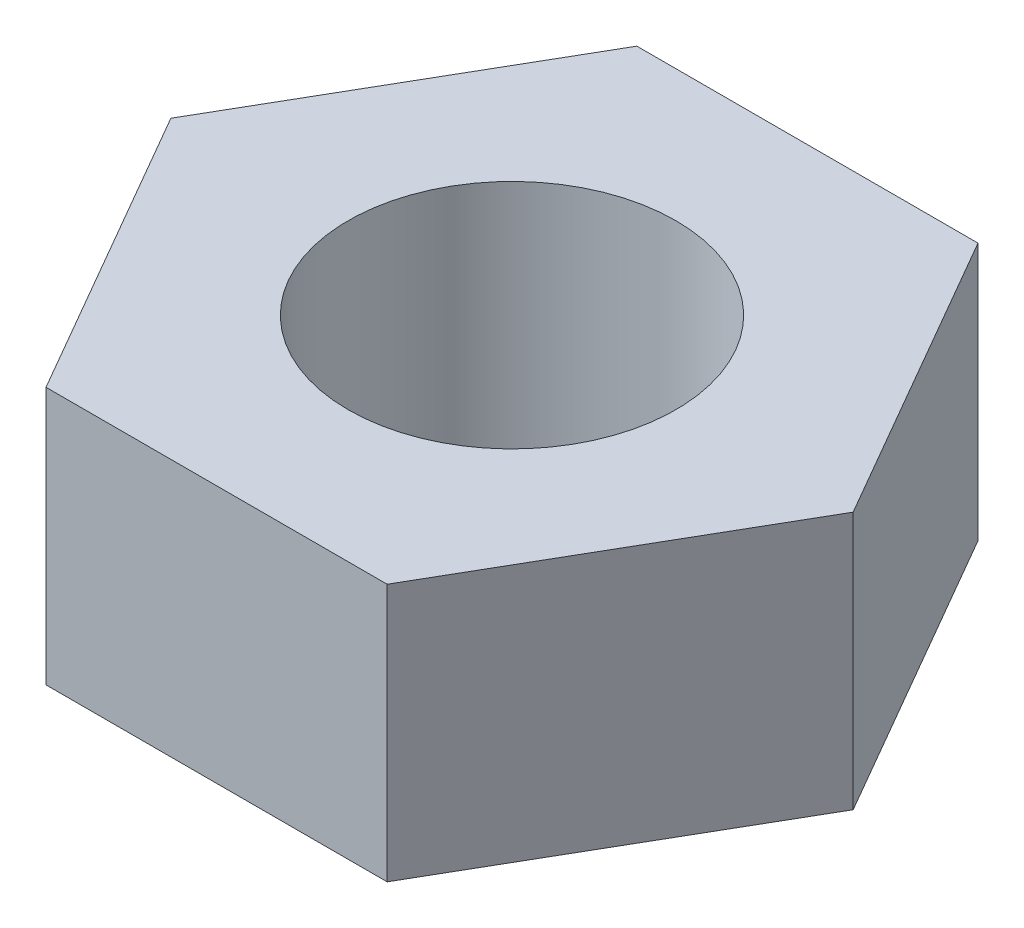
from build123d import *

# Parameters (mm, degrees)
SKETCH1_R           = 1.5
BOSS_EXTRUDE1_DEPTH = 2.36


with BuildPart() as part:
    # Sketch1 → Boss-Extrude1 (new body)
    with BuildSketch(Plane(origin=(0, 0, 0), x_dir=(1, 0, 0), z_dir=(0, 1, 0))):
        Polygon((3.123464956, 0), (1.561732478, 2.705), (-1.561732478, 2.705), (-3.123464956, 0), (-1.561732478, -2.705), (1.561732478, -2.705), align=None)
        with Locations(Location((0, 0, 0), (0, 0, 90))):
            Circle(SKETCH1_R, mode=Mode.SUBTRACT)
    extrude(amount=BOSS_EXTRUDE1_DEPTH)


solid = part.part
